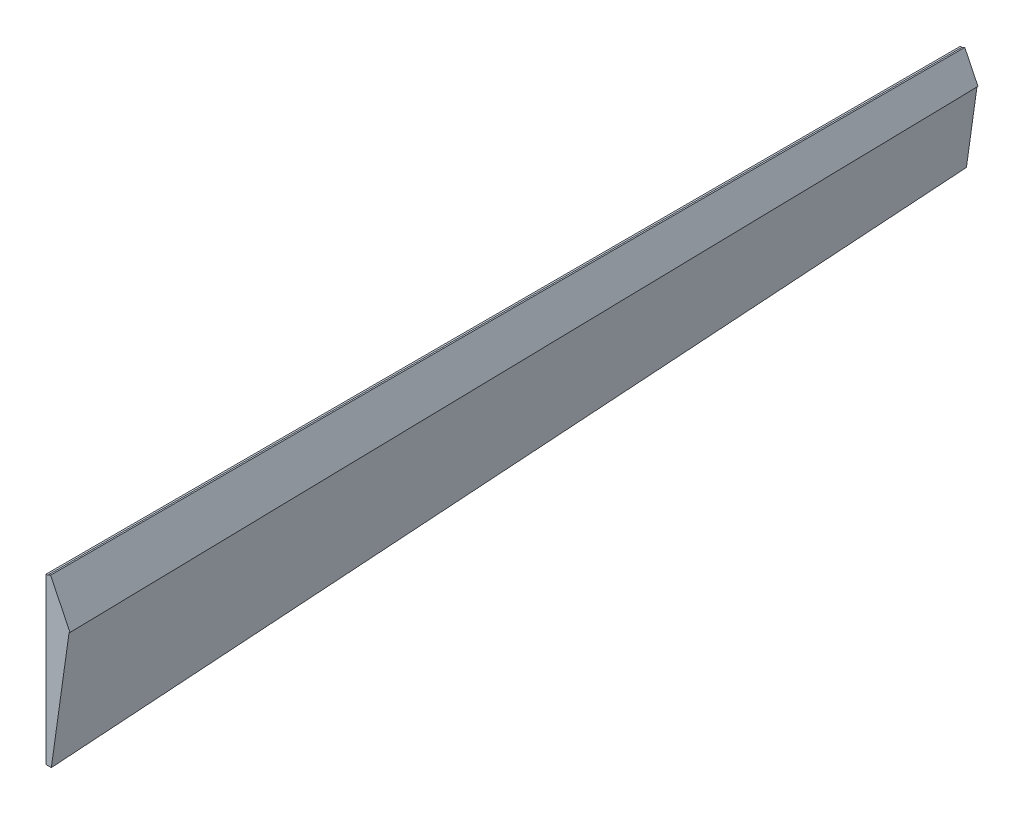
from build123d import *


with BuildPart() as part:
    # 草图2 → 放样1 section 0
    with BuildSketch(Plane.XY):
        with BuildLine():
            Line((0, -64.046772386), (3.909209818, -64.046772386))
            Line((3.909209818, -64.046772386), (10.589538167, -16.513766316))
            Line((10.589538167, -16.513766316), (11.199107472, -16.216459501))
            Line((11.199107472, -16.216459501), (2.862195914, 0.876742294))
            Line((2.862195914, 0.876742294), (1.064607822, 0))
            Line((1.064607822, 0), (0, 0))
            Line((0, 0), (0, -64.046772386))
        make_face()
    # 草图4 → 放样1 section 1
    with BuildSketch(Plane.XY.offset(575.24)):
        with BuildLine():
            Line((0, -103.762640376), (3.35790611, -103.762640376))
            Line((3.35790611, -103.762640376), (14.519874435, -24.508173078))
            Line((14.519874435, -24.508173078), (15.104236542, -24.223160634))
            Line((15.104236542, -24.223160634), (2.862195914, 0.876742294))
            Line((2.862195914, 0.876742294), (1.064607822, 0))
            Line((1.064607822, 0), (0, 0))
            Line((0, 0), (0, -103.762640376))
        make_face()
    loft()


solid = part.part
